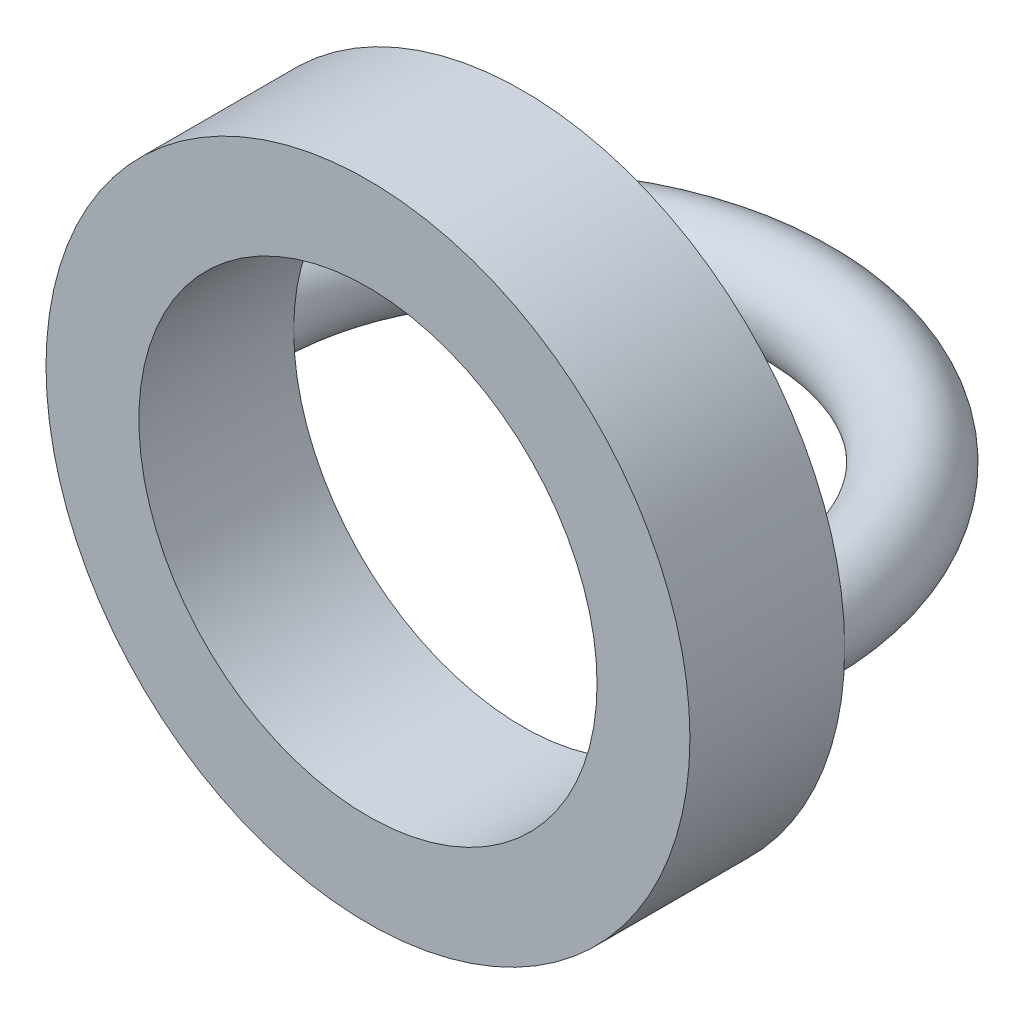
from build123d import *

# Parameters (mm, degrees)
SKETCH1_R           = 10.4
SKETCH1_R_2         = 7.4
BOSS_EXTRUDE1_DEPTH = 5
SKETCH5_R           = 1.5


with BuildPart() as part:
    # Sketch1 → Boss-Extrude1 (new body)
    with BuildSketch(Plane.XY):
        Circle(SKETCH1_R)
        Circle(SKETCH1_R_2, mode=Mode.SUBTRACT)
    extrude(amount=BOSS_EXTRUDE1_DEPTH)

    # Sweep1: sweep along a path in Sketch6
    with BuildLine(Plane(origin=(0, 0, 0), x_dir=(1, 0, 0), z_dir=(0, 1, 0))) as sweep1_path:
        ThreePointArc((-8.9, 0), (0, 8.9), (8.9, 0))
    # Sketch5 → Sweep1 (sweep)
    with BuildSketch(Plane(origin=(0, 0, 0), x_dir=(-1, 0, 0), z_dir=(0, 0, -1))):
        with Locations((8.9, 0)):
            Circle(SKETCH5_R)
    sweep(path=sweep1_path.line)


solid = part.part
